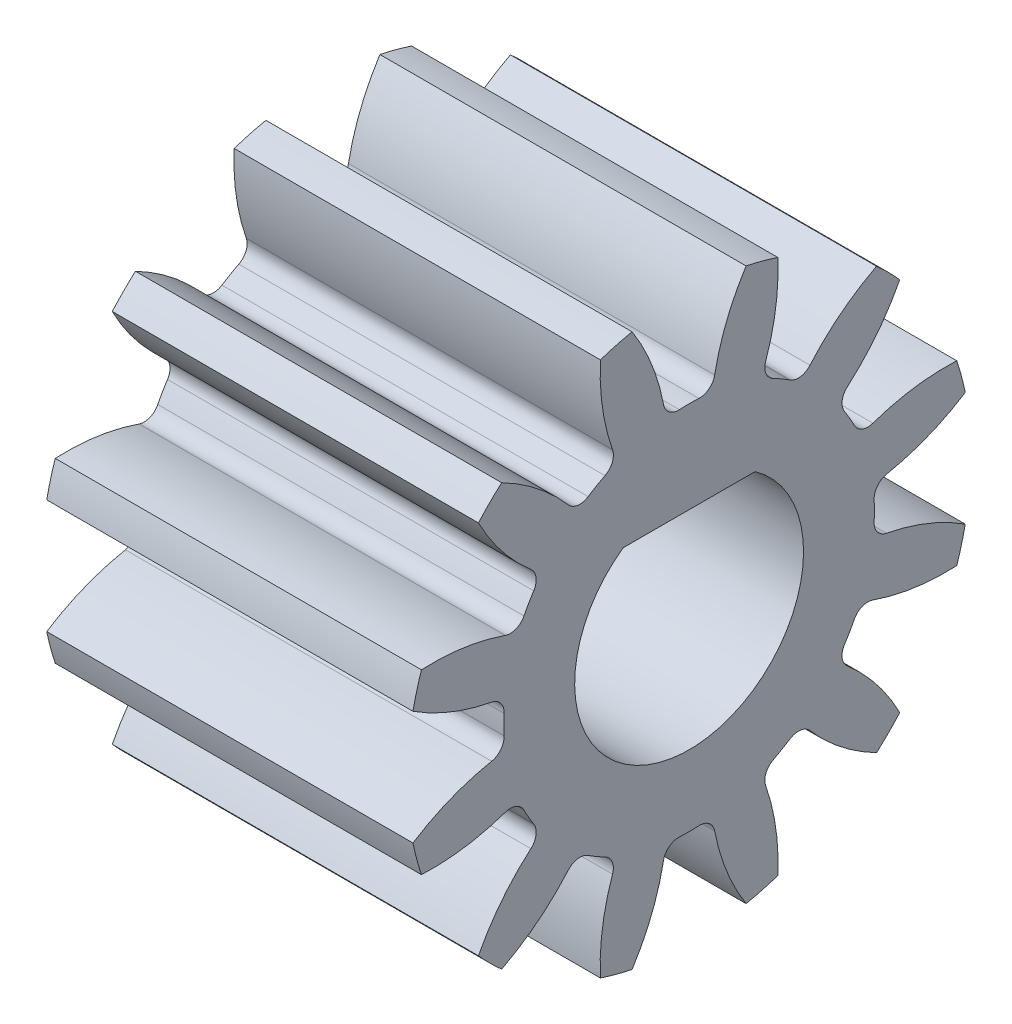
from build123d import *

# Parameters (mm, degrees)
SKETCH1_R                = 7.7
SKETCH1_R_2              = 3.125
BOSS_EXTRUDE2_DEPTH      = 10
CUT_EXTRUDE1_DEPTH       = 15.784451292
FILLET1_R                = 0.418
CIRPATTERN2_COUNT        = 12
FILLET1_OF_CIRPATTERN2_R = 0.418
BOSS_EXTRUDE3_DEPTH      = 10


with BuildPart() as part:
    # Sketch1 → Boss-Extrude2 (new body)
    with BuildSketch(Plane(origin=(0, 0, 0), x_dir=(0, 0, -1), z_dir=(1, 0, 0))):
        Circle(SKETCH1_R)
        Circle(SKETCH1_R_2, mode=Mode.SUBTRACT)
    extrude(amount=BOSS_EXTRUDE2_DEPTH)

    # Sketch3 → Cut-Extrude1 (cut, through all)
    with BuildSketch(Plane(origin=(10, 0, 0), x_dir=(0, 0, -1), z_dir=(1, 0, 0))):
        with BuildLine():
            ThreePointArc((0.63897454, 5.019493155), (0, 5.06), (-0.63897454, 5.019493155))
            ThreePointArc((-0.63897454, 5.019493155), (-0.957043307, 6.331493583), (-1.556726114, 7.540994882))
            ThreePointArc((-1.556726114, 7.540994882), (0, 7.7), (1.556726114, 7.540994882))
            ThreePointArc((1.556726114, 7.540994882), (0.957043307, 6.331493583), (0.63897454, 5.019493155))
        make_face()
    cut_extrude1 = extrude(amount=-CUT_EXTRUDE1_DEPTH, mode=Mode.SUBTRACT)

    # Fillet1
    fillet1_edges = [part.edges().sort_by_distance(p)[0] for p in [
        (5, 5.019493155, 0.63897454),
        (5, 5.019493155, -0.63897454),
    ]]
    fillet(fillet1_edges, radius=FILLET1_R)

    # CirPattern2: Cut-Extrude1 ×12 about axis
    cirpattern2_axis = Axis((0, 0, 0), (1, 0, 0))
    for i in range(1, CIRPATTERN2_COUNT):
        add(cut_extrude1.rotate(cirpattern2_axis, i * 360 / CIRPATTERN2_COUNT), mode=Mode.SUBTRACT)

    # Fillet1 of CirPattern2
    fillet1_of_cirpattern2_edges = [part.edges().sort_by_distance(p)[0] for p in [
        (5, 4.027521317, 3.063114762),
        (5, 4.666495857, 1.956378393),
        (5, 1.956378393, 4.666495857),
        (5, 3.063114762, 4.027521317),
        (5, -0.63897454, 5.019493155),
        (5, 0.63897454, 5.019493155),
        (5, -3.063114762, 4.027521317),
        (5, -1.956378393, 4.666495857),
        (5, -4.666495857, 1.956378393),
        (5, -4.027521317, 3.063114762),
        (5, -5.019493155, -0.63897454),
        (5, -5.019493155, 0.63897454),
        (5, -4.027521317, -3.063114762),
        (5, -4.666495857, -1.956378393),
        (5, -1.956378393, -4.666495857),
        (5, -3.063114762, -4.027521317),
        (5, 0.63897454, -5.019493155),
        (5, -0.63897454, -5.019493155),
        (5, 3.063114762, -4.027521317),
        (5, 1.956378393, -4.666495857),
        (5, 4.666495857, -1.956378393),
        (5, 4.027521317, -3.063114762),
    ]]
    fillet(fillet1_of_cirpattern2_edges, radius=FILLET1_OF_CIRPATTERN2_R)

    # Sketch4 → Boss-Extrude3 (add)
    with BuildSketch(Plane.ZY):
        with BuildLine():
            Line((-1.8, 2.55453029), (1.8, 2.55453029))
            ThreePointArc((1.8, 2.55453029), (0, 3.15453029), (-1.8, 2.55453029))
        make_face()
    extrude(amount=-BOSS_EXTRUDE3_DEPTH)


solid = part.part
